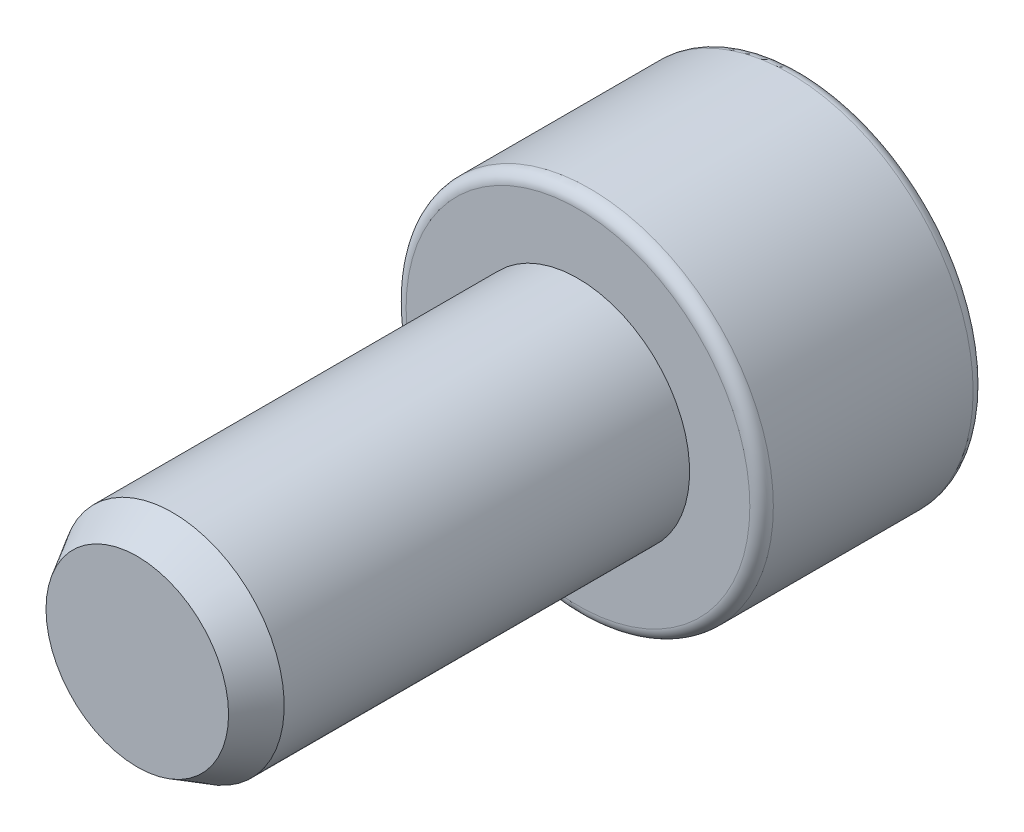
from build123d import *

# Parameters (mm, degrees)
CUT_EXTRUDE1_DEPTH  = 2.54
SKETCH3_R           = 2.413
BOSS_EXTRUDE1_DEPTH = 9.525
CHAMFER1_SIZE       = 0.762
CHAMFER1_SIZE2      = 0.439940905


with BuildPart() as part:
    # Sketch1 → Revolve1 (revolve)
    with BuildSketch(Plane(origin=(0, 0, 0), x_dir=(1, 0, 0), z_dir=(0, 1, 0))):
        with BuildLine():
            Line((0, 0), (3.71475, 0))
            ThreePointArc((3.71475, 0), (3.894355122, -0.074394878), (3.96875, -0.254))
            Line((3.96875, -0.254), (3.96875, -4.572))
            ThreePointArc((3.96875, -4.572), (3.894355122, -4.751605122), (3.71475, -4.826))
            Line((3.71475, -4.826), (0, -4.826))
            Line((0, -4.826), (0, 0))
        make_face()
    revolve(axis=Axis((0, 0, 0), (0, 0, -1)))

    # Sketch2 → Cut-Extrude1 (cut)
    with BuildSketch(Plane(origin=(0, 0, 0), x_dir=(-1, 0, 0), z_dir=(0, 0, -1))):
        Polygon((0, 2.291358881), (-1.984375, 1.14567944), (-1.984375, -1.14567944), (0, -2.291358881), (1.984375, -1.14567944), (1.984375, 1.14567944), align=None)
    extrude(amount=-CUT_EXTRUDE1_DEPTH, mode=Mode.SUBTRACT)

    # Sketch3 → Boss-Extrude1 (add)
    with BuildSketch(Plane.XY.offset(4.826)):
        with Locations(Location((0, 0, 0), (0, 0, 180))):
            Circle(SKETCH3_R)
    extrude(amount=BOSS_EXTRUDE1_DEPTH)

    # Chamfer1
    chamfer1_edges = [part.edges().sort_by_distance(p)[0] for p in [
        (2.413, 0, 14.351),
    ]]
    chamfer1_side = [part.faces().sort_by_distance(p)[0] for p in [
        (2.413, 0, 9.5885),
    ]]
    chamfer(chamfer1_edges, length=CHAMFER1_SIZE, length2=CHAMFER1_SIZE2, reference=chamfer1_side[0])


solid = part.part
